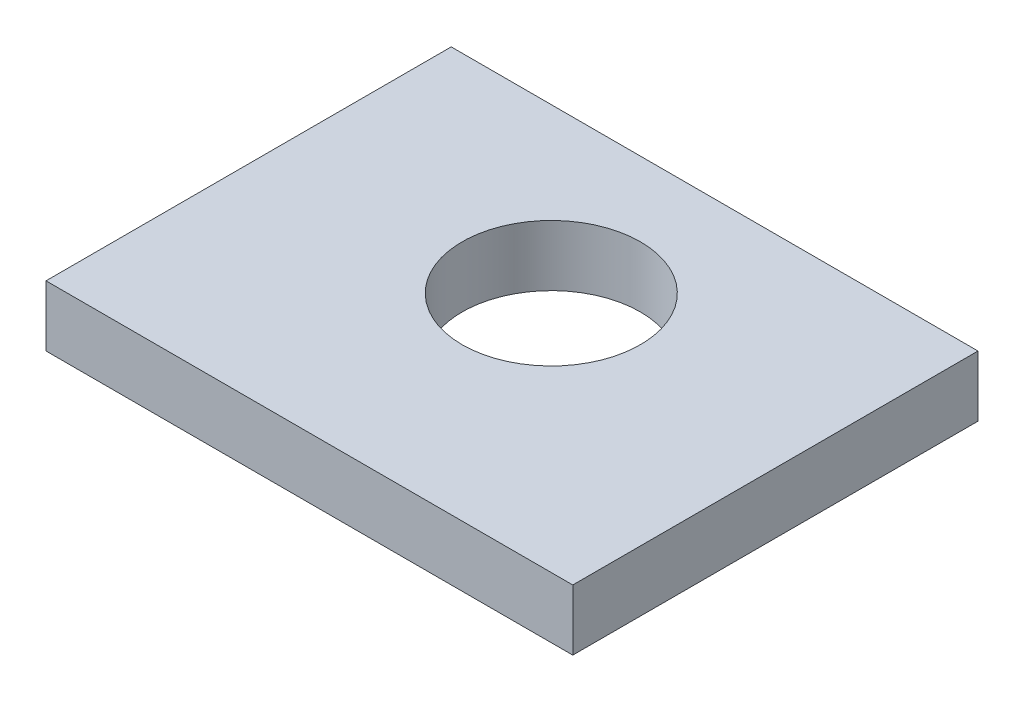
from build123d import *

# Parameters (mm, degrees)
SKETCH1_W           = 6.5
SKETCH1_H           = 5
BOSS_EXTRUDE1_DEPTH = 0.75
SKETCH2_R           = 1.1
CUT_EXTRUDE1_DEPTH  = 5.168333


with BuildPart() as part:
    # Sketch1 → Boss-Extrude1 (new body)
    with BuildSketch(Plane(origin=(0, 0, 0), x_dir=(1, 0, 0), z_dir=(0, 1, 0))):
        Rectangle(SKETCH1_W, SKETCH1_H)
    extrude(amount=BOSS_EXTRUDE1_DEPTH)

    # Sketch2 → Cut-Extrude1 (cut, through all)
    with BuildSketch(Plane(origin=(0, 0, 0), x_dir=(1, 0, 0), z_dir=(0, 1, 0))):
        with Locations(Location((0, 0.484711092, 0), (0, 0, 270))):
            Circle(SKETCH2_R)
    extrude(amount=CUT_EXTRUDE1_DEPTH, mode=Mode.SUBTRACT)


solid = part.part
